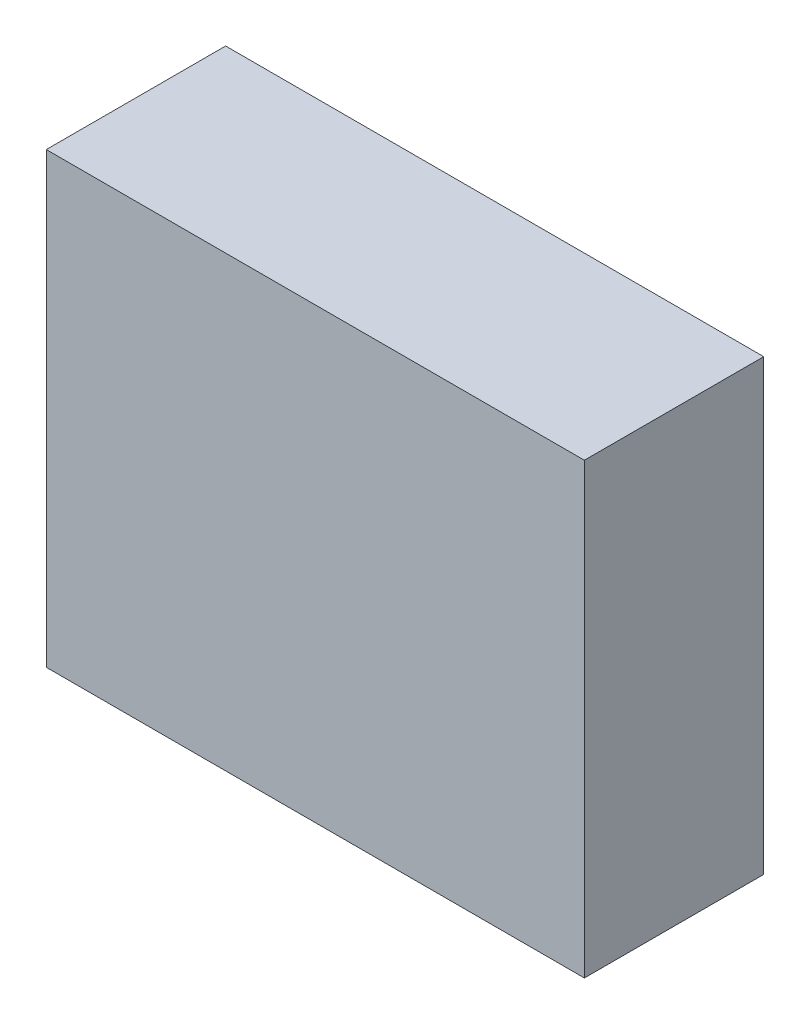
from build123d import *

# Parameters (mm, degrees)
SKETCH_1_W      = 30
SKETCH_1_H      = 25
EXTRUDE_1_DEPTH = 10


with BuildPart() as part:
    # 草图1 → 凸台-拉伸1 (new body)
    with BuildSketch(Plane.XY):
        with Locations((15, -12.5)):
            Rectangle(SKETCH_1_W, SKETCH_1_H)
    extrude(amount=EXTRUDE_1_DEPTH)


solid = part.part
